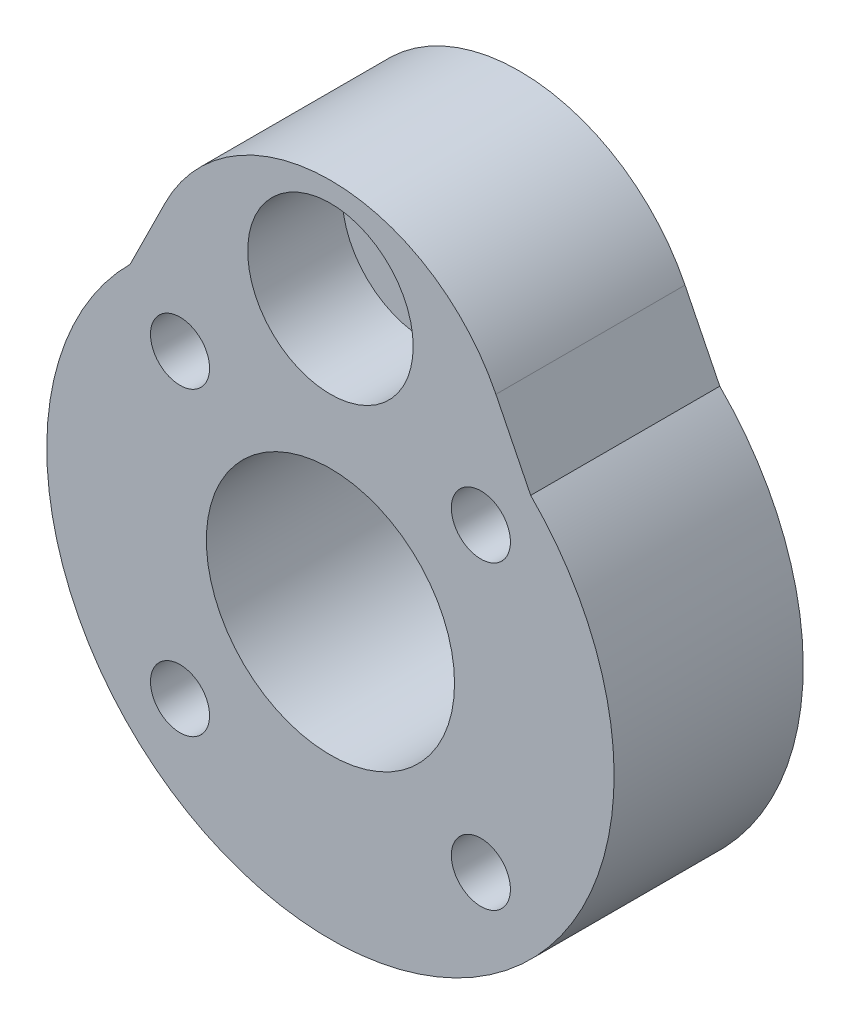
from build123d import *

# Parameters (mm, degrees)
ESQUISSE1_R             = 12
ESQUISSE1_R_2           = 5.25
BOSS_EXTRU_1_DEPTH      = 8
BOSS_EXTRU_2_DEPTH      = 8
ESQUISSE3_R             = 1.25
ENL_V_MAT_EXTRU_1_DEPTH = 22.401408884
ESQUISSE4_R             = 2
ENL_V_MAT_EXTRU_2_DEPTH = 22.401408884
ESQUISSE5_R             = 3.5
ENL_V_MAT_EXTRU_3_DEPTH = 4


with BuildPart() as part:
    # Esquisse1 → Boss.-Extru.1 (new body)
    with BuildSketch(Plane.XY):
        Circle(ESQUISSE1_R)
        Circle(ESQUISSE1_R_2, mode=Mode.SUBTRACT)
    extrude(amount=BOSS_EXTRU_1_DEPTH)

    # Esquisse2 → Boss.-Extru.2 (add)
    with BuildSketch(Plane.XY.offset(8)):
        with BuildLine():
            Line((-7, 11.468114388), (-8.470537173, 8.5))
            Line((-8.470537173, 8.5), (0, 8.5))
            Line((0, 8.5), (8.470537173, 8.5))
            Line((8.470537173, 8.5), (7, 11.468114388))
            ThreePointArc((7, 11.468114388), (0, 15.8120303), (-7, 11.468114388))
        make_face()
    extrude(amount=-BOSS_EXTRU_2_DEPTH)

    # Esquisse3 → Enlèv. mat.-Extru.1 (cut, through all)
    with BuildSketch(Plane.XY.offset(8)):
        with Locations((-6.363961031, 6.363961031)):
            Circle(ESQUISSE3_R)
        with Locations((6.363961031, 6.363961031)):
            Circle(ESQUISSE3_R)
        with Locations((6.363961031, -6.363961031)):
            Circle(ESQUISSE3_R)
        with Locations((-6.363961031, -6.363961031)):
            Circle(ESQUISSE3_R)
    extrude(amount=-ENL_V_MAT_EXTRU_1_DEPTH, mode=Mode.SUBTRACT)

    # Esquisse4 → Enlèv. mat.-Extru.2 (cut, through all)
    with BuildSketch(Plane.XY.offset(8)):
        with Locations((0, 11.468114388)):
            Circle(ESQUISSE4_R)
    extrude(amount=-ENL_V_MAT_EXTRU_2_DEPTH, mode=Mode.SUBTRACT)

    # Esquisse5 → Enlèv. mat.-Extru.3 (cut)
    with BuildSketch(Plane.XY.offset(8)):
        with Locations((0, 11.468114388)):
            Circle(ESQUISSE5_R)
    extrude(amount=-ENL_V_MAT_EXTRU_3_DEPTH, mode=Mode.SUBTRACT)


solid = part.part
